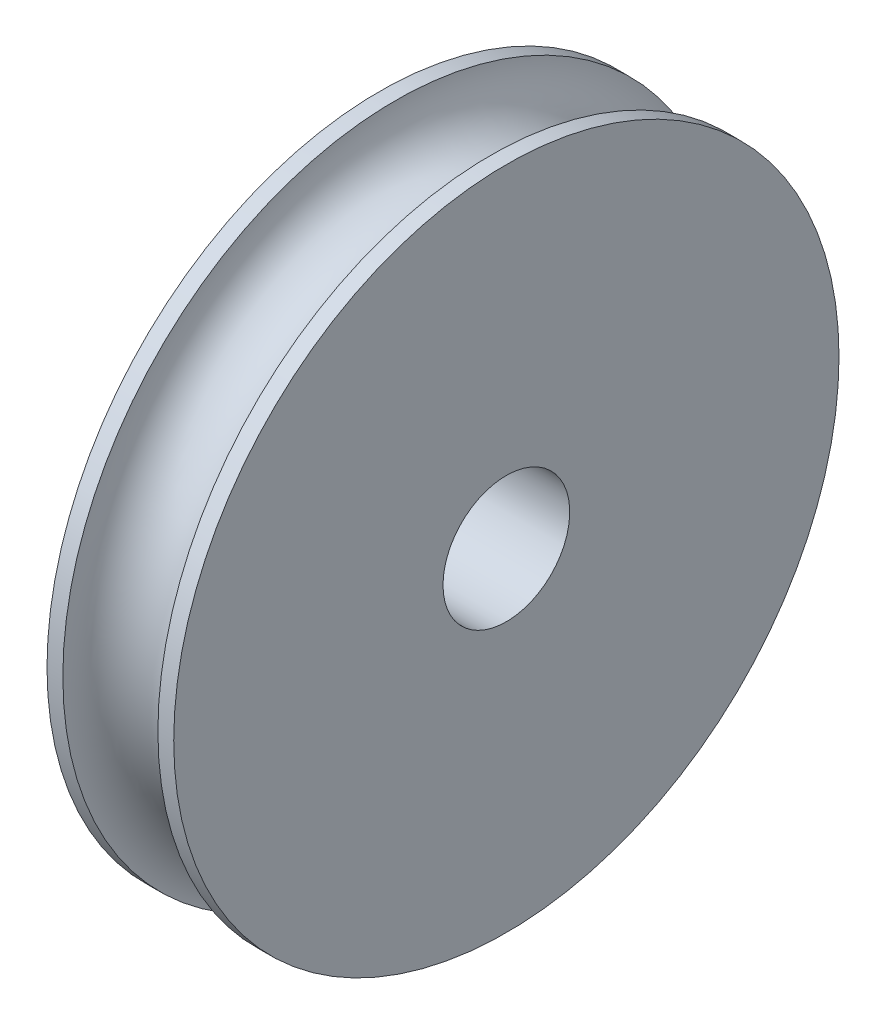
from build123d import *


with BuildPart() as part:
    # Sketch1 → Revolve1 (revolve)
    with BuildSketch(Plane(origin=(0, 0, 0), x_dir=(1, 0, 0), z_dir=(0, 1, 0))):
        with BuildLine():
            Line((0, -1), (2, -1))
            Line((2, -1), (2, -5.25))
            Line((2, -5.25), (1.75, -5.25))
            ThreePointArc((1.75, -5.25), (1, -4.5), (0.25, -5.25))
            Line((0.25, -5.25), (0, -5.25))
            Line((0, -5.25), (0, -1))
        make_face()
    revolve(axis=Axis((0, 0, 0), (1, 0, 0)))


solid = part.part
